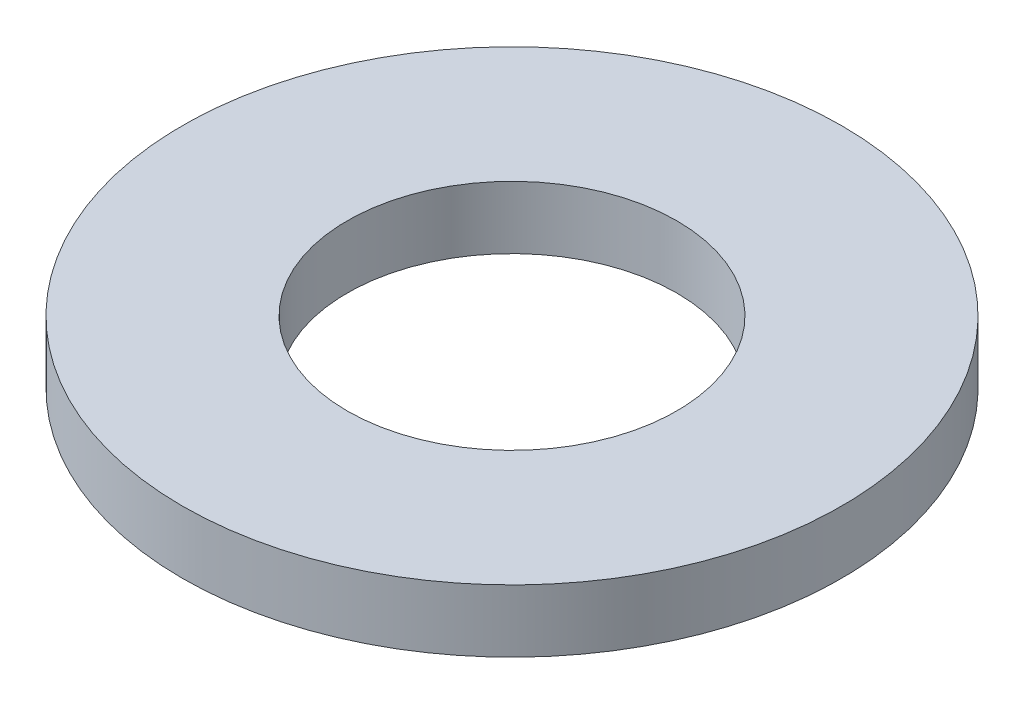
from build123d import *

# Parameters (mm, degrees)
SKETCH_1_R      = 6
SKETCH_1_R_2    = 3
EXTRUDE_1_DEPTH = 1.14


with BuildPart() as part:
    # Эскиз1 → Бобышка-Вытянуть1 (new body)
    with BuildSketch(Plane(origin=(0, 0, 0), x_dir=(1, 0, 0), z_dir=(0, 1, 0))):
        with Locations(Location((0, 0, 0), (0, 0, 270))):
            Circle(SKETCH_1_R)
        with Locations(Location((0, 0, 0), (0, 0, 270))):
            Circle(SKETCH_1_R_2, mode=Mode.SUBTRACT)
    extrude(amount=EXTRUDE_1_DEPTH)


solid = part.part
